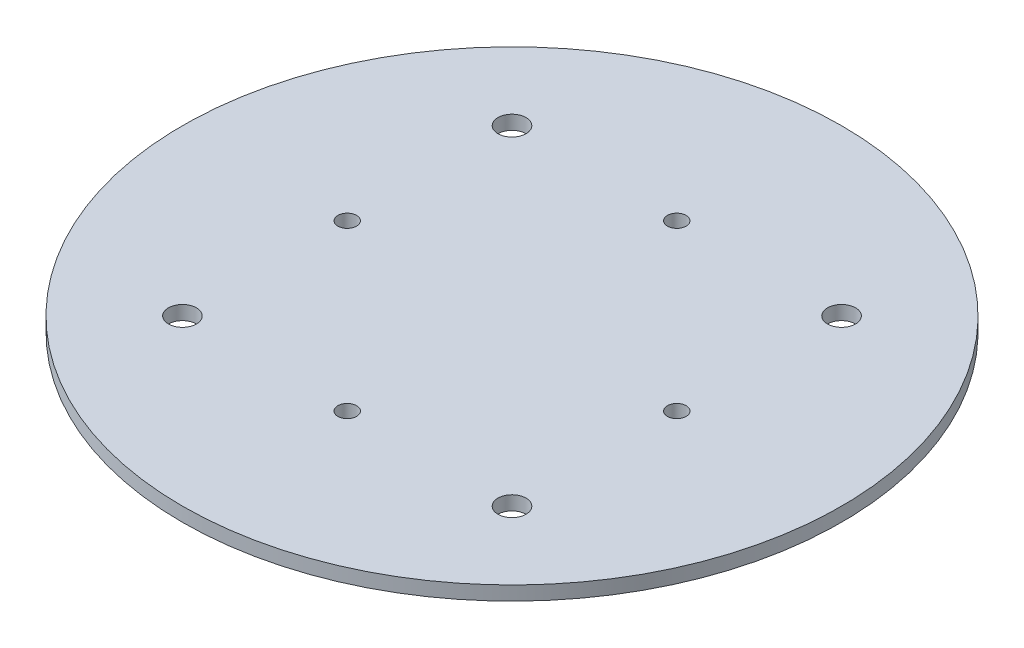
from build123d import *

# Parameters (mm, degrees)
BASE_CIRCLE_R               = 70.5
BASE_CIRCLE_THICKNESS_DEPTH = 3
SCREW_HOLES_R               = 2
SCREW_HOLES_R_2             = 3
BASE_SCREW_DRILLS_DEPTH     = 3


with BuildPart() as part:
    # Base circle → Base circle thickness (new body)
    with BuildSketch(Plane(origin=(0, 0, 0), x_dir=(1, 0, 0), z_dir=(0, 1, 0))):
        with Locations(Location((0, 0, 0), (0, 0, 270))):
            Circle(BASE_CIRCLE_R)
    extrude(amount=BASE_CIRCLE_THICKNESS_DEPTH)

    # Screw holes → Base screw drills (cut)
    with BuildSketch(Plane(origin=(0, 0, 0), x_dir=(-1, 0, 0), z_dir=(0, -1, 0))):
        with Locations(Location((35.25, 0, 0), (0, 0, 90))):
            Circle(SCREW_HOLES_R)
        with Locations(Location((0, 35.25, 0), (0, 0, 90))):
            Circle(SCREW_HOLES_R)
        with Locations(Location((-35.25, 0, 0), (0, 0, 90))):
            Circle(SCREW_HOLES_R)
        with Locations(Location((0, -35.25, 0), (0, 0, 90))):
            Circle(SCREW_HOLES_R)
        with Locations(Location((35.25, 35.25, 0), (0, 0, 90))):
            Circle(SCREW_HOLES_R_2)
        with Locations(Location((35.25, -35.25, 0), (0, 0, 90))):
            Circle(SCREW_HOLES_R_2)
        with Locations(Location((-35.25, -35.25, 0), (0, 0, 90))):
            Circle(SCREW_HOLES_R_2)
        with Locations(Location((-35.25, 35.25, 0), (0, 0, 90))):
            Circle(SCREW_HOLES_R_2)
    extrude(amount=-BASE_SCREW_DRILLS_DEPTH, mode=Mode.SUBTRACT)


solid = part.part
